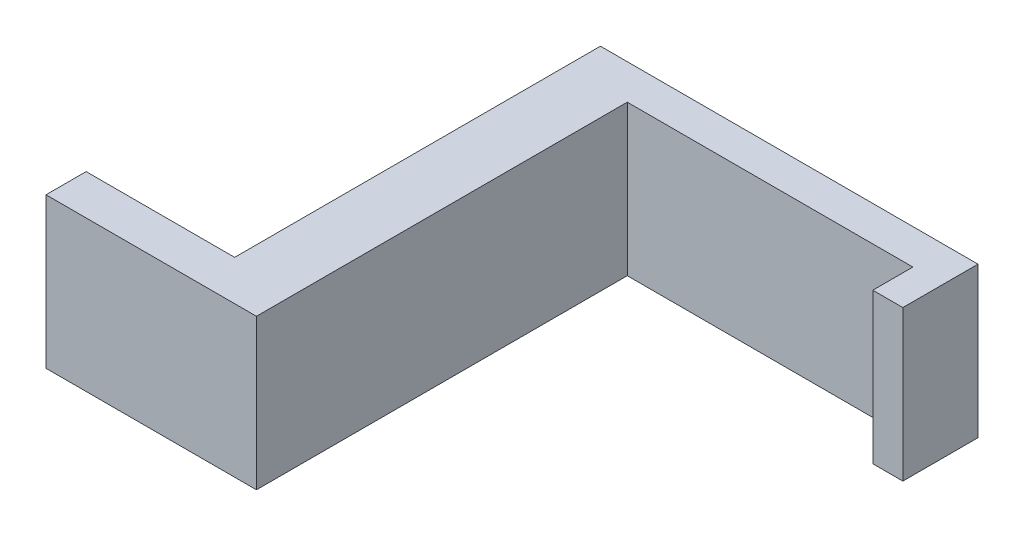
from build123d import *

# Parameters (mm, degrees)
BOSS_EXTRUDE1_DEPTH = 10


with BuildPart() as part:
    # Sketch2 → Boss-Extrude1 (new body)
    with BuildSketch(Plane(origin=(0, 0, 0), x_dir=(1, 0, 0), z_dir=(0, 1, 0))):
        Polygon((0, 0), (0, 22), (19, 22), (19, 19.333142244), (21, 19.333142244), (21, 24.333142244), (-4.119501692, 24.333142244), (-4.119501692, 0), (-14, 0), (-14, -2.670585351), (0, -2.670585351), align=None)
    extrude(amount=BOSS_EXTRUDE1_DEPTH)


solid = part.part
